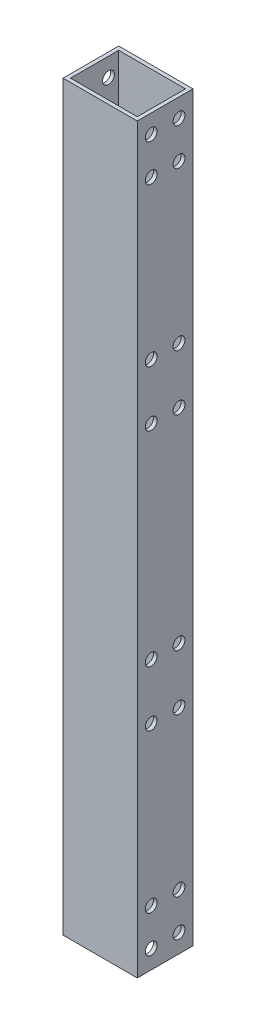
from build123d import *

# Parameters (mm, degrees)
SKETCH_1_W          = 20
SKETCH_1_H          = 15
SKETCH_1_W_2        = 18
SKETCH_1_H_2        = 13
EXTRUDE_1_DEPTH     = 200
SKETCH_3_R          = 1.6
CUT_EXTRUDE_1_DEPTH = 202.137390855
SKETCH_4_R          = 1.6
CUT_EXTRUDE_2_DEPTH = 202.137390855


with BuildPart() as part:
    # 草图1 → 拉伸-薄壁1 (new body)
    with BuildSketch(Plane(origin=(0, 0, 0), x_dir=(1, 0, 0), z_dir=(0, 1, 0))):
        Rectangle(SKETCH_1_W, SKETCH_1_H)
        Rectangle(SKETCH_1_W_2, SKETCH_1_H_2, mode=Mode.SUBTRACT)
    extrude(amount=EXTRUDE_1_DEPTH)

    # 草图3 → 切除-拉伸1 (cut, through all)
    with BuildSketch(Plane(origin=(10, 0, 0), x_dir=(0, 0, -1), z_dir=(1, 0, 0))):
        with Locations((-3.75, 142.5)):
            Circle(SKETCH_3_R)
        with Locations((-3.75, 127.5)):
            Circle(SKETCH_3_R)
        with Locations((3.75, 127.5)):
            Circle(SKETCH_3_R)
        with Locations((3.75, 142.5)):
            Circle(SKETCH_3_R)
        with Locations((-3.75, 72.5)):
            Circle(SKETCH_3_R)
        with Locations((3.75, 72.5)):
            Circle(SKETCH_3_R)
        with Locations((3.75, 57.5)):
            Circle(SKETCH_3_R)
        with Locations((-3.75, 57.5)):
            Circle(SKETCH_3_R)
    extrude(amount=-CUT_EXTRUDE_1_DEPTH, mode=Mode.SUBTRACT)

    # 草图4 → 切除-拉伸2 (cut, through all)
    with BuildSketch(Plane(origin=(10, 0, 0), x_dir=(0, 0, -1), z_dir=(1, 0, 0))):
        with Locations((-3.75, 5)):
            Circle(SKETCH_4_R)
        with Locations((-3.75, 15)):
            Circle(SKETCH_4_R)
        with Locations((3.75, 5)):
            Circle(SKETCH_4_R)
        with Locations((3.75, 15)):
            Circle(SKETCH_4_R)
        with Locations((3.75, 185)):
            Circle(SKETCH_4_R)
        with Locations((3.75, 195)):
            Circle(SKETCH_4_R)
        with Locations((-3.75, 185)):
            Circle(SKETCH_4_R)
        with Locations((-3.75, 195)):
            Circle(SKETCH_4_R)
    extrude(amount=-CUT_EXTRUDE_2_DEPTH, mode=Mode.SUBTRACT)


solid = part.part
